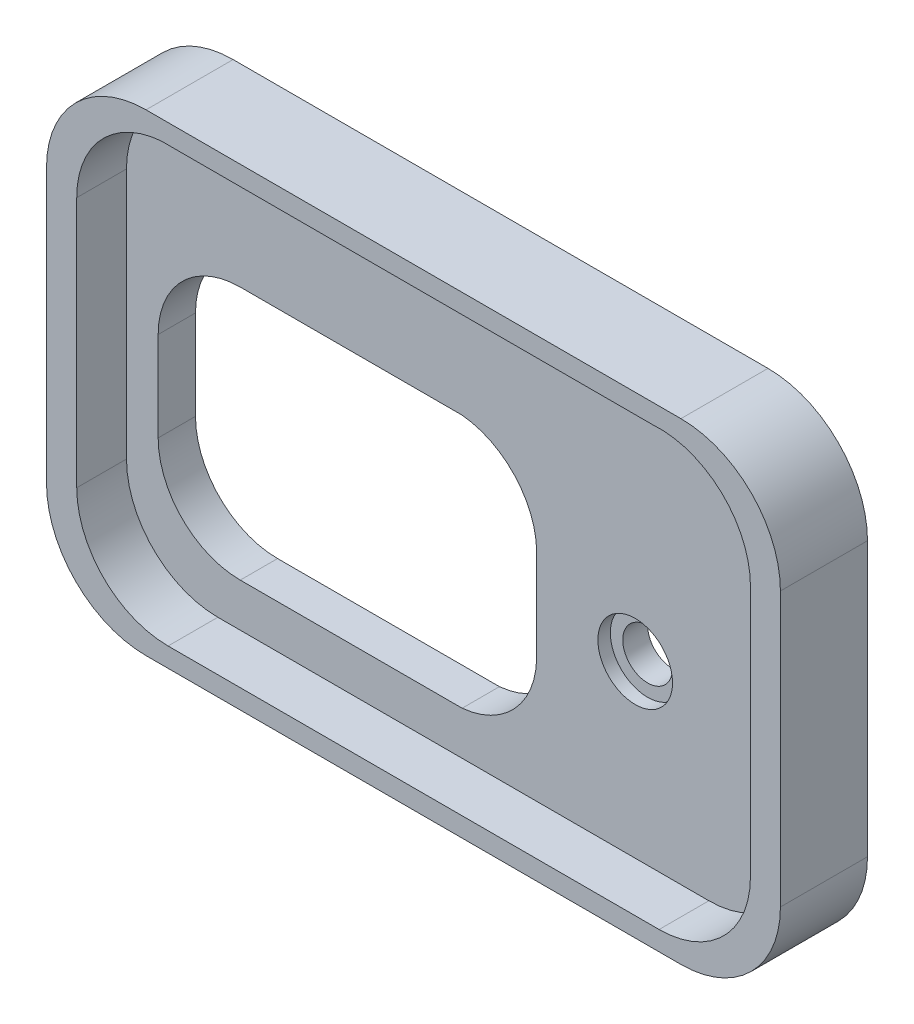
from build123d import *

# Parameters (mm, degrees)
SKETCH1_W           = 37.465
SKETCH1_H           = 24.13
BOSS_EXTRUDE1_DEPTH = 4.445
CUT_EXTRUDE2_DEPTH  = 2.54
FILLET1_R           = 5.08
CUT_EXTRUDE4_DEPTH  = 2.54
SKETCH4_R           = 1.27
CUT_EXTRUDE5_DEPTH  = 2.54
SKETCH5_R           = 1.905
SKETCH5_R_2         = 1.27
CUT_EXTRUDE6_DEPTH  = 0.635
CUT_EXTRUDE7_DEPTH  = 2.54


with BuildPart() as part:
    # Sketch1 → Boss-Extrude1 (new body)
    with BuildSketch(Plane.XY):
        with Locations((18.7325, 12.065)):
            Rectangle(SKETCH1_W, SKETCH1_H)
    extrude(amount=BOSS_EXTRUDE1_DEPTH)

    # Sketch2 → Cut-Extrude2 (cut)
    # profile 1 of 4: a face of its own
    with BuildSketch(Plane.XY.offset(4.445)):
        with BuildLine():
            Line((35.59175, 5.7785), (35.59175, 12.065))
            Line((35.59175, 12.065), (35.59175, 18.3515))
            ThreePointArc((35.59175, 18.3515), (34.135361545, 21.710109865), (30.681521372, 22.9235))
            Line((30.681521372, 22.9235), (18.7325, 22.9235))
            Line((18.7325, 22.9235), (6.107021372, 22.9235))
            ThreePointArc((6.107021372, 22.9235), (3.090639267, 21.470453234), (1.87325, 18.3515))
            Line((1.87325, 18.3515), (1.87325, 12.065))
            Line((1.87325, 12.065), (1.87325, 5.7785))
            ThreePointArc((1.87325, 5.7785), (3.212357796, 2.545607796), (6.44525, 1.2065))
            Line((6.44525, 1.2065), (18.7325, 1.2065))
            Line((18.7325, 1.2065), (31.01975, 1.2065))
            ThreePointArc((31.01975, 1.2065), (34.252642204, 2.545607796), (35.59175, 5.7785))
        make_face()
        with BuildLine():
            ThreePointArc((7.493, 3.175), (4.439712919, 4.439712919), (3.175, 7.493))
            Line((3.175, 7.493), (3.175, 16.637))
            ThreePointArc((3.175, 16.637), (4.317872951, 19.576666289), (7.154771372, 20.955))
            Line((7.154771372, 20.955), (7.493, 20.955))
            Line((7.493, 20.955), (29.633771372, 20.955))
            ThreePointArc((29.633771372, 20.955), (32.908147923, 19.81638289), (34.29, 16.637))
            Line((34.29, 16.637), (34.29, 7.493))
            ThreePointArc((34.29, 7.493), (33.025287081, 4.439712919), (29.972, 3.175))
            Line((29.972, 3.175), (7.493, 3.175))
        make_face(mode=Mode.SUBTRACT)
    # profile 2 of 4: a face of its own
    with BuildSketch(Plane.XY.offset(4.445)):
        with BuildLine():
            ThreePointArc((3.175, 16.637), (4.439712919, 19.690287081), (7.493, 20.955))
            Line((7.493, 20.955), (29.972, 20.955))
            ThreePointArc((29.972, 20.955), (33.025287081, 19.690287081), (34.29, 16.637))
            Line((34.29, 16.637), (34.29, 7.493))
            ThreePointArc((34.29, 7.493), (33.025287081, 4.439712919), (29.972, 3.175))
            Line((29.972, 3.175), (7.493, 3.175))
            ThreePointArc((7.493, 3.175), (4.439712919, 4.439712919), (3.175, 7.493))
            Line((3.175, 7.493), (3.175, 16.637))
        make_face()
    # profile 3 of 4: a face of its own
    with BuildSketch(Plane.XY.offset(4.445)):
        with BuildLine():
            ThreePointArc((7.154771372, 20.955), (4.317872951, 19.576666289), (3.175, 16.637))
            ThreePointArc((3.175, 16.637), (4.439712919, 19.690287081), (7.493, 20.955))
            Line((7.493, 20.955), (7.154771372, 20.955))
        make_face()
    # profile 4 of 4: a face of its own
    with BuildSketch(Plane.XY.offset(4.445)):
        with BuildLine():
            ThreePointArc((34.29, 16.637), (32.908147923, 19.81638289), (29.633771372, 20.955))
            Line((29.633771372, 20.955), (29.972, 20.955))
            ThreePointArc((29.972, 20.955), (33.025287081, 19.690287081), (34.29, 16.637))
        make_face()
    extrude(amount=-CUT_EXTRUDE2_DEPTH, mode=Mode.SUBTRACT)

    # Fillet1
    fillet1_edges = [part.edges().sort_by_distance(p)[0] for p in [
        (0, 24.13, 2.2225),
        (37.465, 24.13, 2.2225),
        (37.465, 0, 2.2225),
        (0, 0, 2.2225),
    ]]
    fillet(fillet1_edges, radius=FILLET1_R)

    # Sketch3 → Cut-Extrude4 (cut)
    with BuildSketch(Plane.XY.offset(1.905)):
        with BuildLine():
            Line((7.350869654, 16.158973759), (18.677995313, 16.158973759))
            ThreePointArc((18.677995313, 16.158973759), (21.522821275, 14.644991178), (22.463869654, 11.5628481))
            Line((22.463869654, 11.5628481), (22.463869654, 7.801099417))
            ThreePointArc((22.463869654, 7.801099417), (21.522821275, 4.718956339), (18.677995313, 3.204973759))
            Line((18.677995313, 3.204973759), (7.350869654, 3.204973759))
            ThreePointArc((7.350869654, 3.204973759), (4.387385134, 4.432489239), (3.159869654, 7.395973759))
            Line((3.159869654, 7.395973759), (3.159869654, 11.967973759))
            ThreePointArc((3.159869654, 11.967973759), (4.387385134, 14.931458278), (7.350869654, 16.158973759))
        make_face()
    extrude(amount=-CUT_EXTRUDE4_DEPTH, mode=Mode.SUBTRACT)

    # Sketch4 → Cut-Extrude5 (cut)
    with BuildSketch(Plane.XY.offset(1.905)):
        with Locations((27.511650569, 9.68988988)):
            Circle(SKETCH4_R)
    extrude(amount=-CUT_EXTRUDE5_DEPTH, mode=Mode.SUBTRACT)

    # Sketch5 → Cut-Extrude6 (cut)
    with BuildSketch(Plane.XY.offset(1.905)):
        with Locations((27.511650569, 9.68988988)):
            Circle(SKETCH5_R)
        with Locations((27.511650569, 9.68988988)):
            Circle(SKETCH5_R_2, mode=Mode.SUBTRACT)
    extrude(amount=-CUT_EXTRUDE6_DEPTH, mode=Mode.SUBTRACT)

    # Sketch6 → Cut-Extrude7 (cut)
    with BuildSketch(Plane.XY.offset(4.445)):
        with BuildLine():
            Line((1.542829573, 18.47723), (1.542829573, 5.65277))
            ThreePointArc((1.542829573, 5.65277), (2.908719525, 2.355219952), (6.206269573, 0.98933))
            Line((6.206269573, 0.98933), (31.272259573, 0.98933))
            ThreePointArc((31.272259573, 0.98933), (34.56980962, 2.355219952), (35.935699573, 5.65277))
            Line((35.935699573, 5.65277), (35.935699573, 18.47723))
            ThreePointArc((35.935699573, 18.47723), (34.450183348, 21.903012063), (30.927266372, 23.14067))
            Line((30.927266372, 23.14067), (5.861276372, 23.14067))
            ThreePointArc((5.861276372, 23.14067), (2.784566625, 21.658562299), (1.542829573, 18.47723))
        make_face()
        with BuildLine():
            Line((6.44525, 1.2065), (31.01975, 1.2065))
            ThreePointArc((31.01975, 1.2065), (34.252642204, 2.545607796), (35.59175, 5.7785))
            Line((35.59175, 5.7785), (35.59175, 18.3515))
            ThreePointArc((35.59175, 18.3515), (34.135361545, 21.710109865), (30.681521372, 22.9235))
            Line((30.681521372, 22.9235), (6.107021372, 22.9235))
            ThreePointArc((6.107021372, 22.9235), (3.090639267, 21.470453234), (1.87325, 18.3515))
            Line((1.87325, 18.3515), (1.87325, 5.7785))
            ThreePointArc((1.87325, 5.7785), (3.212357796, 2.545607796), (6.44525, 1.2065))
        make_face(mode=Mode.SUBTRACT)
    extrude(amount=-CUT_EXTRUDE7_DEPTH, mode=Mode.SUBTRACT)


solid = part.part
